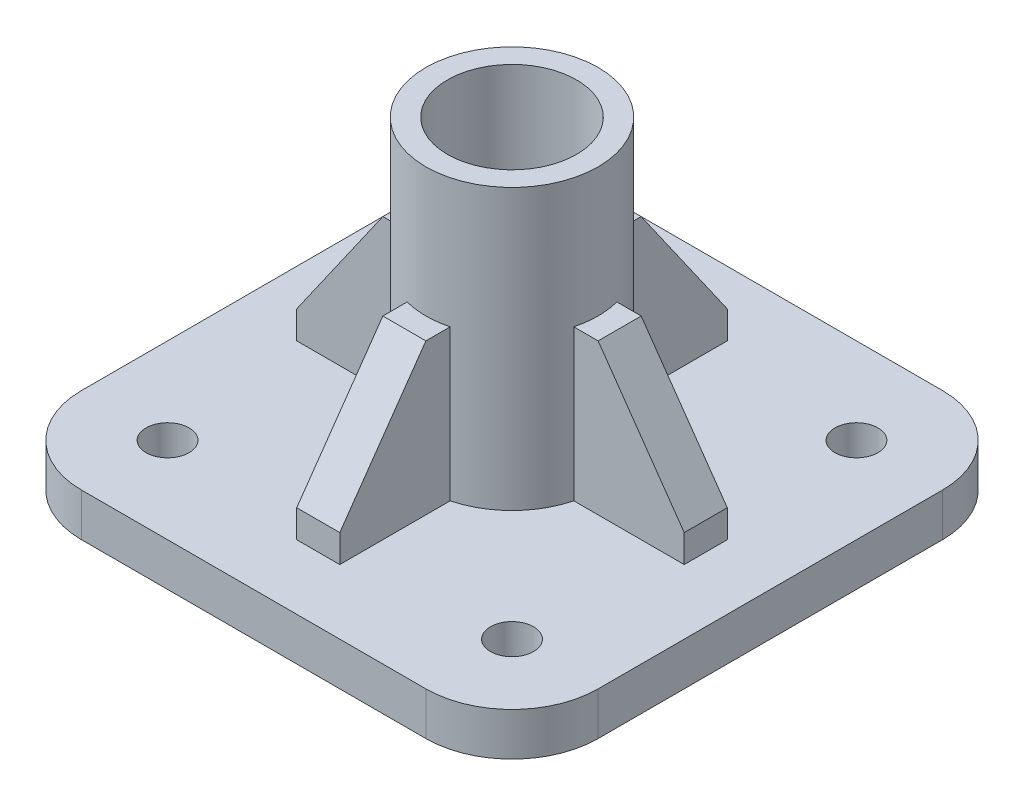
from build123d import *

# Parameters (mm, degrees)
BOSS_EXTRUDE1_DEPTH            = 10
SKETCH2_R                      = 20
BOSS_EXTRUDE2_DEPTH            = 75
BOSS_EXTRUDE3_DEPTH            = 5
CHAMFER1_SIZE                  = 20
CHAMFER1_SIZE2                 = 28.562960134842417
CIRPATTERN1_COUNT              = 4
CHAMFER1_OF_CIRPATTERN1_SIZE2  = 28.562960134842417
CHAMFER1_OF_CIRPATTERN1_SIZE   = 20
SKETCH4_R                      = 15
CUT_EXTRUDE1_DEPTH             = 114.24751652906124
FILLET1_R                      = 20
F_10_0_10_DIAMETER_HOLE1_D     = 10
F_10_0_10_DIAMETER_HOLE1_DEPTH = 10
F_10_0_10_DIAMETER_HOLE1_TIP   = 3.0043030951378014


with BuildPart() as part:
    # Sketch1 → Boss-Extrude1 (new body)
    with BuildSketch(Plane(origin=(0, 0, 0), x_dir=(1, 0, 0), z_dir=(0, 1, 0))):
        Polygon((-60.00000000000001, 59.99999999999999), (59.99999999999999, 59.99999999999999), (60.00000000000001, -60.00000000000001), (-59.99999999999999, -60.00000000000001), align=None)
    extrude(amount=BOSS_EXTRUDE1_DEPTH)

    # Sketch2 → Boss-Extrude2 (add)
    with BuildSketch(Plane.XZ):
        with Locations(Location((0, 0, 0), (0, 0, 270))):
            Circle(SKETCH2_R)
    extrude(amount=-BOSS_EXTRUDE2_DEPTH)

    # Sketch3 → Boss-Extrude3 (add, symmetric)
    with BuildSketch(Plane.XY):
        Polygon((0, 10), (-45, 9.999999999999995), (-45, 45), (0, 45), align=None)
    boss_extrude3 = extrude(amount=BOSS_EXTRUDE3_DEPTH, both=True)

    # Chamfer1
    chamfer1_edges = [part.edges().sort_by_distance(p)[0] for p in [
        (-45, 45, 0),
    ]]
    chamfer1_side = [part.faces().sort_by_distance(p)[0] for p in [
        (-32.39412654979103, 45, 2.29e-15),
    ]]
    chamfer(chamfer1_edges, length=CHAMFER1_SIZE, length2=CHAMFER1_SIZE2, reference=chamfer1_side[0])

    # CirPattern1: Boss-Extrude3 ×4 about axis
    cirpattern1_axis = Axis((-1.07e-15, 0, 7e-17), (0, 1, 0))
    for i in range(1, CIRPATTERN1_COUNT):
        add(boss_extrude3.rotate(cirpattern1_axis, i * 360 / CIRPATTERN1_COUNT))

    # Chamfer1 of CirPattern1
    chamfer1_of_cirpattern1_edges = [part.edges().sort_by_distance(p)[0] for p in [
        (-3.9e-15, 45, 45),
        (45, 45, 5.66e-15),
        (7.27e-15, 45, -45),
    ]]
    chamfer(chamfer1_of_cirpattern1_edges, length=CHAMFER1_OF_CIRPATTERN1_SIZE, length2=CHAMFER1_OF_CIRPATTERN1_SIZE2)

    # Sketch4 → Cut-Extrude1 (cut, through all)
    with BuildSketch(Plane(origin=(0, 75, 0), x_dir=(1, 0, 0), z_dir=(0, 1, 0))):
        with Locations(Location((0, 0, 0), (0, 0, 270))):
            Circle(SKETCH4_R)
    extrude(amount=-CUT_EXTRUDE1_DEPTH, mode=Mode.SUBTRACT)

    # Fillet1
    fillet1_edges = [part.edges().sort_by_distance(p)[0] for p in [
        (60.00000000000001, 5, 60.00000000000001),
        (-59.99999999999999, 5, 60.00000000000001),
        (-60.00000000000001, 5, -59.99999999999999),
        (59.99999999999999, 5, -59.99999999999999),
    ]]
    fillet(fillet1_edges, radius=FILLET1_R)

    # Ø10.0 (10) Diameter Hole1
    with Locations(Plane(origin=(0, 10, 0), x_dir=(-1, 0, 0), z_dir=(0, 1, 0))):
        with Locations((40, -40), (40, 40), (-40, 40), (-40, -40)):
            Hole(F_10_0_10_DIAMETER_HOLE1_D / 2, depth=F_10_0_10_DIAMETER_HOLE1_DEPTH)
            with Locations((0, 0, -(F_10_0_10_DIAMETER_HOLE1_DEPTH + F_10_0_10_DIAMETER_HOLE1_TIP / 2))):  # 118° drill point
                Cone(0, F_10_0_10_DIAMETER_HOLE1_D / 2, F_10_0_10_DIAMETER_HOLE1_TIP, mode=Mode.SUBTRACT)


solid = part.part
